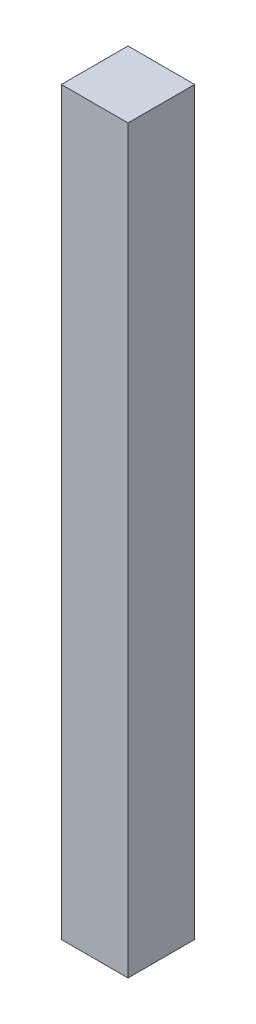
from build123d import *

# Parameters (mm, degrees)
TOPPING_KLAPE_KAT3_GAZLI_AMORTISOR_1_1_START = 8
SKETCH1_W                                    = 18
SKETCH1_H                                    = 200
TOPPING_KLAPE_KAT3_GAZLI_AMORTISOR_1_1_DEPTH = 18


with BuildPart() as part:
    # Sketch1 → TOPPING_klape_kat3_gazli_amortisor_1_1 (new body)
    with BuildSketch(Plane.XY.offset(TOPPING_KLAPE_KAT3_GAZLI_AMORTISOR_1_1_START)):
        with Locations((54, 870)):
            Rectangle(SKETCH1_W, SKETCH1_H)
    extrude(amount=TOPPING_KLAPE_KAT3_GAZLI_AMORTISOR_1_1_DEPTH)


solid = part.part
